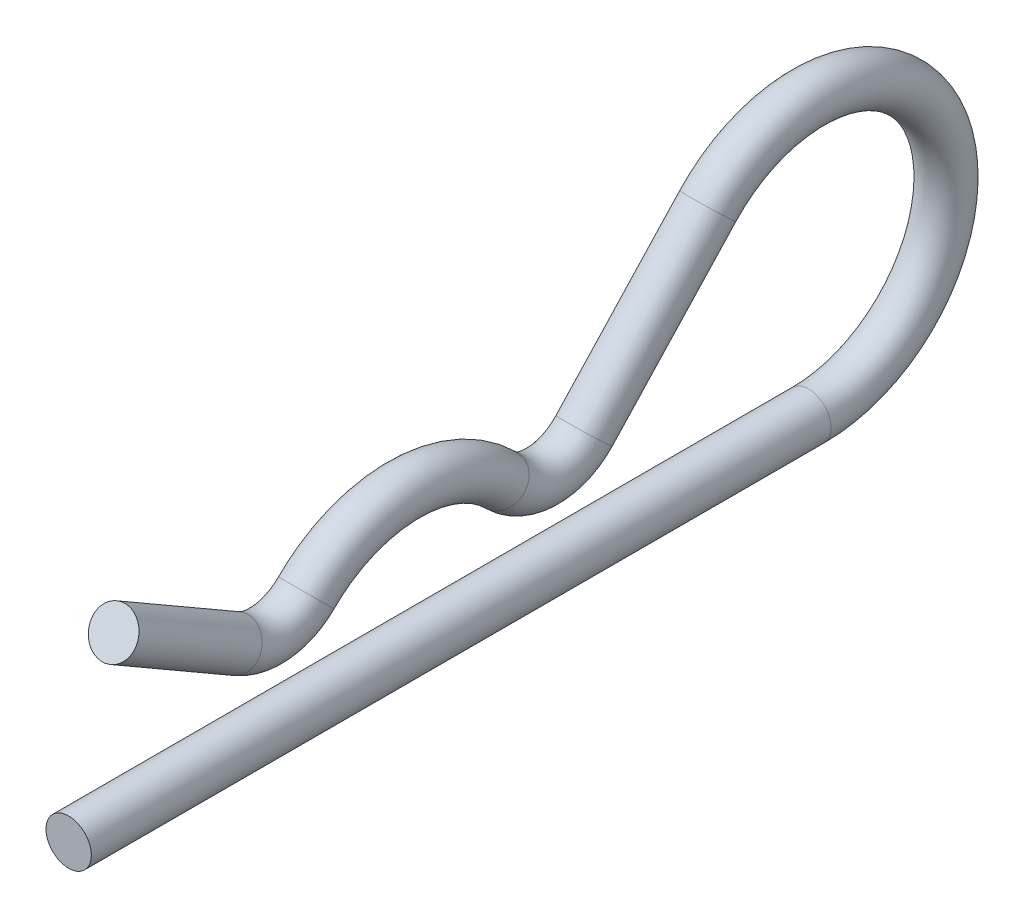
from build123d import *

# Parameters (mm, degrees)
SKETCH2_R = 1.8796


with BuildPart() as part:
    # Sweep1: sweep along a path in Sketch3
    with BuildLine(Plane(origin=(0, 0, 0), x_dir=(0, 0, -1), z_dir=(1, 0, 0))) as sweep1_path:
        Line((-33.575625, 1.770477967), (-23.365317207, -4.124445986))
        ThreePointArc((-23.365317207, -4.124445986), (-20.356812443, -4.721012361), (-17.60845825, -3.359564022))
        ThreePointArc((-17.60845825, -3.359564022), (-9.525, 0), (-1.44154175, -3.359564022))
        ThreePointArc((-1.44154175, -3.359564022), (2.013563586, -4.761836471), (5.419936173, -3.245015223))
        Line((5.419936173, -3.245015223), (15.674555782, 7.770729788))
        ThreePointArc((15.674555782, 7.770729788), (34.478793425, 4.552078439), (24.02205, -11.4046))
        Line((24.02205, -11.4046), (-37.30625, -11.4046))
    # Sketch2 → Sweep1 (sweep)
    with BuildSketch(Plane.XY.offset(37.30625)):
        with Locations((0, -11.4046)):
            Circle(SKETCH2_R)
    sweep(path=sweep1_path.line)


solid = part.part
